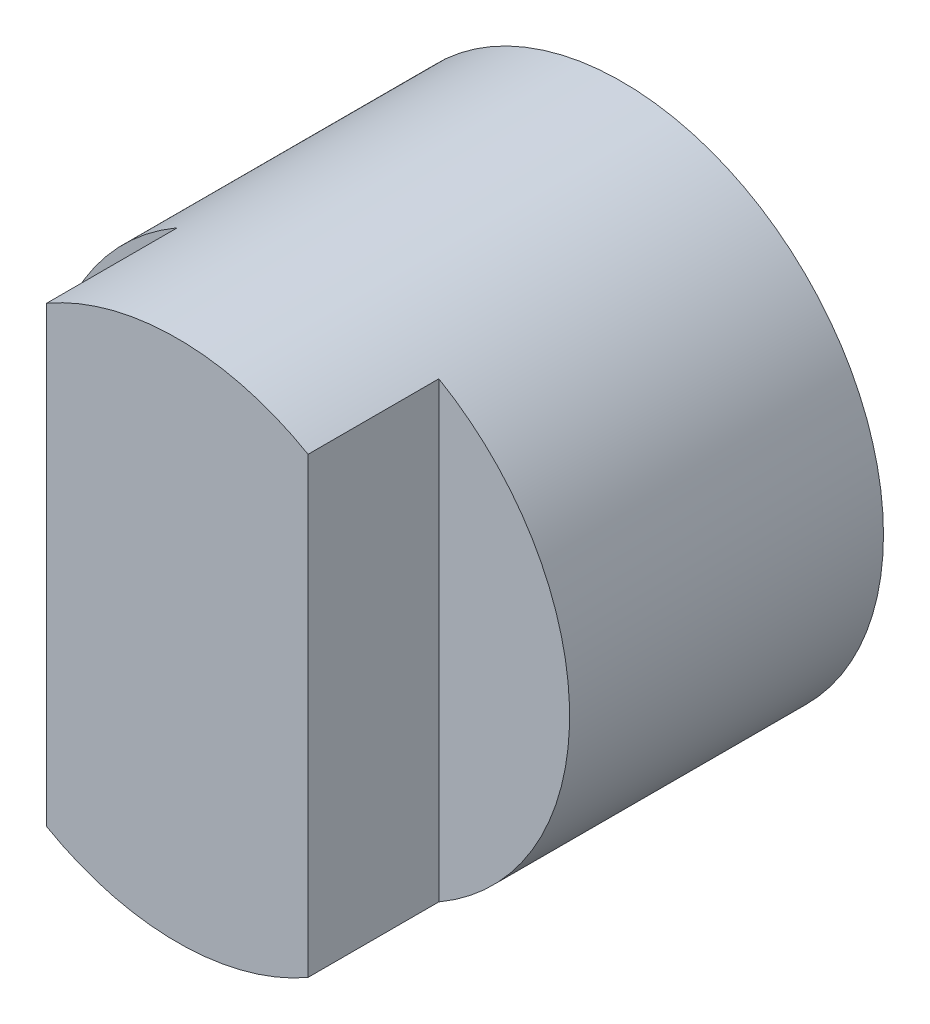
from build123d import *

# Parameters (mm, degrees)
ESBO_O1_R                  = 10
RESSALTO_EXTRUS_O1_DEPTH   = 17
CORTE_EXTRUS_O1_START      = -5
CORTE_EXTRUS_O1_DEPTH      = 5
CORTE_EXTRUS_O2_DEPTH      = 15
CORTE_EXTRUS_O3_REACH      = 25.472
CORTE_EXTRUS_O3_END_RADIUS = 10
ESBO_O4_R                  = 1.5


with BuildPart() as part:
    # Esboço1 → Ressalto-extrusão1 (new body)
    with BuildSketch(Plane.XY):
        Circle(ESBO_O1_R)
    extrude(amount=RESSALTO_EXTRUS_O1_DEPTH)

    # Esboço2 → Corte-extrusão1 (cut)
    with BuildSketch(Plane.XY.offset(17).offset(CORTE_EXTRUS_O1_START)):
        with BuildLine():
            Line((-5, 8.660254038), (-5, -8.660254038))
            ThreePointArc((-5, -8.660254038), (-10, 0), (-5, 8.660254038))
        make_face()
        with BuildLine():
            Line((5, 8.660254038), (5, -8.660254038))
            ThreePointArc((5, -8.660254038), (10, 0), (5, 8.660254038))
        make_face()
    extrude(amount=CORTE_EXTRUS_O1_DEPTH, mode=Mode.SUBTRACT)

    # Esboço3 → Corte-extrusão2 (cut)
    with BuildSketch(Plane(origin=(0, 0, 0), x_dir=(-1, 0, 0), z_dir=(0, 0, -1))):
        with BuildLine():
            Line((0, -2.725), (1.629417074, -2.725))
            ThreePointArc((1.629417074, -2.725), (0, 3.175), (-1.629417074, -2.725))
            Line((-1.629417074, -2.725), (0, -2.725))
        make_face()
    extrude(amount=-CORTE_EXTRUS_O2_DEPTH, mode=Mode.SUBTRACT)

    # Corte-extrusão3: up to this cylinder (the profile starts inside it)
    corte_extrus_o3_end = Plane(origin=(0, 0, 7), z_dir=(0, 0, -1)) * Cylinder(CORTE_EXTRUS_O3_END_RADIUS, 71.944, mode=Mode.PRIVATE)
    # Esboço4 → Corte-extrusão3 (cut, up to the surface)
    with BuildSketch(Plane(origin=(0, -2.725, 0), x_dir=(1, 0, 0), z_dir=(0, 1, 0)), mode=Mode.PRIVATE) as corte_extrus_o3_sk1:
        with Locations(Location((0, -7, 0), (0, 0, 270))):
            Circle(ESBO_O4_R)
    corte_extrus_o3_tool1 = extrude(corte_extrus_o3_sk1.sketch, amount=-CORTE_EXTRUS_O3_REACH, mode=Mode.PRIVATE) & corte_extrus_o3_end
    add(corte_extrus_o3_tool1.solids().sort_by_distance((0, -2.725, 7))[0], mode=Mode.SUBTRACT)


solid = part.part
